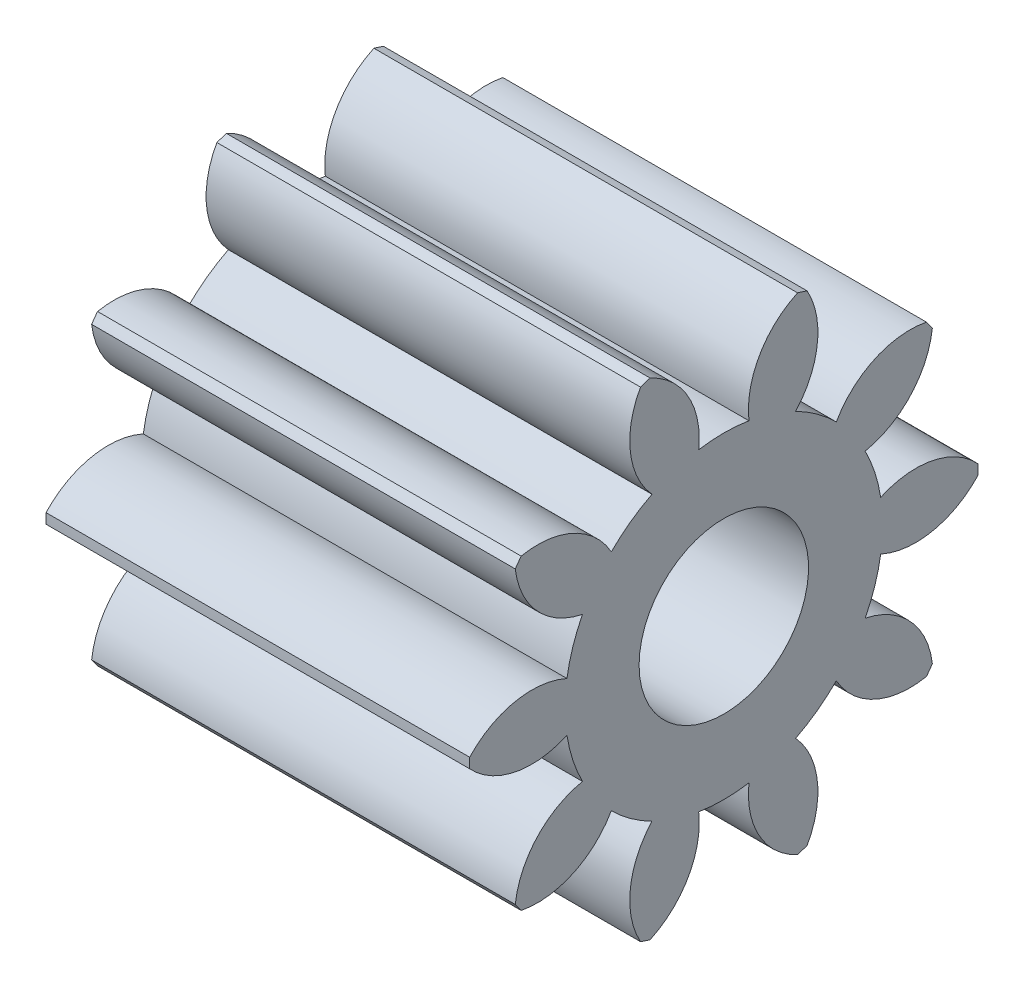
from build123d import *

# Parameters (mm, degrees)
BASPROSKE_W     = 5
BASPROSKE_H     = 3
TOOTHCUT_DEPTH  = 7.557438524
TEETHCUTS_COUNT = 10
TEETHCUTS_ANGLE = 324
BORSKE_R        = 1
BORE_DEPTH      = 50.0000508


with BuildPart() as part:
    # BasProSke → Base-Revolve (revolve)
    with BuildSketch(Plane(origin=(0, 0, 0), x_dir=(1, 0, 0), z_dir=(0, 1, 0)), mode=Mode.PRIVATE) as base_revolve_sk:
        with Locations((2.5, 1.5)):
            Rectangle(BASPROSKE_W, BASPROSKE_H)
    revolve(base_revolve_sk.sketch.rotate(Axis((-10, 0, 0), (1, 0, 0)), 180), axis=Axis((-10, 0, 0), (1, 0, 0)))

    # TooCutSke → ToothCut (cut, through all)
    with BuildSketch(Plane(origin=(0, 0, 0), x_dir=(0, 0, -1), z_dir=(1, 0, 0))):
        with BuildLine():
            ThreePointArc((0.296449938, 1.850403587), (0, 1.874), (-0.296449938, 1.850403587))
            ThreePointArc((-0.296449938, 1.850403587), (-0.428089565, 2.470295585), (-0.905889751, 2.886591228))
            ThreePointArc((-0.905889751, 2.886591228), (0, 3.0254), (0.905889751, 2.886591228))
            ThreePointArc((0.905889751, 2.886591228), (0.428089565, 2.470295585), (0.296449938, 1.850403587))
        make_face()
    toothcut = extrude(amount=TOOTHCUT_DEPTH, mode=Mode.SUBTRACT)

    # TeethCuts: ToothCut ×10 about axis
    teethcuts_axis = Axis((-10, 0, 0), (1, 0, 0))
    for i in range(1, TEETHCUTS_COUNT):
        add(toothcut.rotate(teethcuts_axis, i * TEETHCUTS_ANGLE / (TEETHCUTS_COUNT - 1)), mode=Mode.SUBTRACT)

    # BorSke → Bore (cut, symmetric)
    with BuildSketch(Plane(origin=(0, 0, 0), x_dir=(0, 0, -1), z_dir=(1, 0, 0))):
        with Locations(Location((0, 0, 0), (0, 0, 180))):
            Circle(BORSKE_R)
    extrude(amount=BORE_DEPTH, both=True, mode=Mode.SUBTRACT)


solid = part.part
